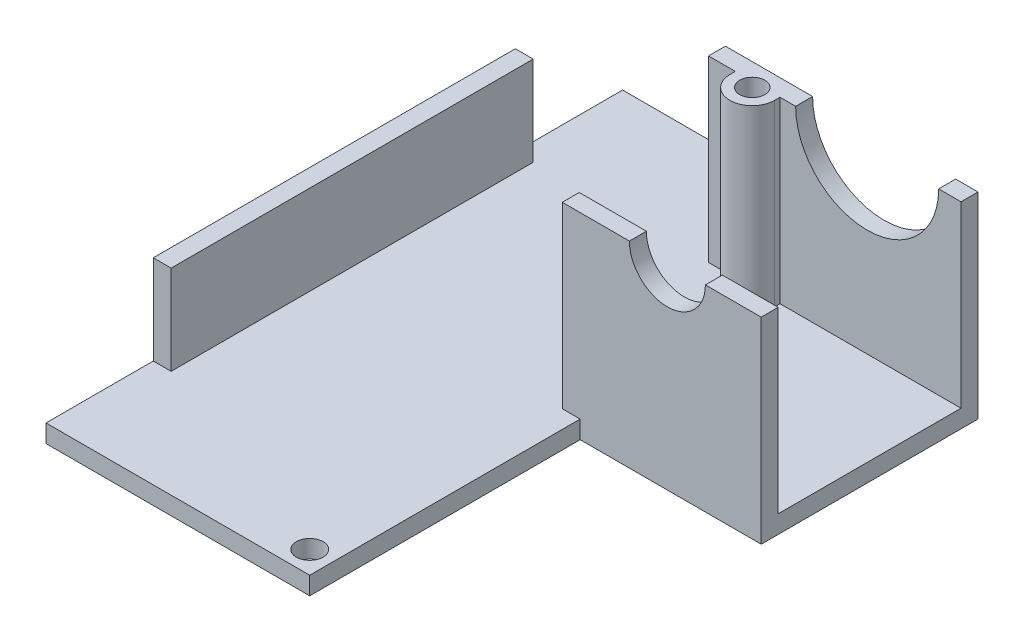
from build123d import *

# Parameters (mm, degrees)
BOSS_EXTRUDE1_DEPTH                 = 2
BOSS_EXTRUDE1_2_DEPTH               = 2
BOSS_EXTRUDE2_DEPTH                 = 1.9
BOSS_EXTRUDE3_DEPTH                 = 1.9
F_16_0MM_DOWEL_HOLE1_D              = 16
F_16_0MM_DOWEL_HOLE1_DEPTH          = 1.9
BOSS_EXTRUDE4_DEPTH                 = 2
F_8_0MM_DOWEL_HOLE1_D               = 8.5
SKETCH10_W                          = 5
SKETCH10_H                          = 3.1
BOSS_EXTRUDE5_DEPTH                 = 20
F_3_0MM_DOWEL_HOLE1_D               = 2.8
F_3_0MM_DOWEL_HOLE1_DEPTH           = 20
F_5_0MM_DOWEL_HOLE1_D               = 3
F_5_0MM_DOWEL_HOLE1_DEPTH           = 2
F_5_0MM_DOWEL_HOLE1_ON_FACE_2_D     = 3
F_5_0MM_DOWEL_HOLE1_ON_FACE_2_DEPTH = 2
FILLET1_RADIUS                      = 2.5
FILLET1_LENGTH                      = 20


with BuildPart() as part:
    # 3DSketch1 → Boss-Extrude1 (new body)
    with BuildSketch(Plane(origin=(0, 0, 0), x_dir=(0.4159263542190885, 0, 0.9093982999027529), z_dir=(0, 1, 0))):
        Polygon((9.774269324, 21.370860048), (0, 0), (58.656190344, -26.827249847), (70.926017793, 0), (43.416719221, 12.581772215), (21.363810448, 22.667986305), (18.868252323, 17.211596506), align=None)
    extrude(amount=BOSS_EXTRUDE1_DEPTH)



with BuildPart() as body_2:
    # 3DSketch1 → Boss-Extrude1 2 (new body)
    with BuildSketch(Plane(origin=(0, 0, 0), x_dir=(0.4159263542190885, 0, 0.9093982999027529), z_dir=(0, 1, 0))):
        Polygon((21.363810448, 22.667986305), (43.416719221, 12.581772215), (51.839227894, 30.997087788), (29.786319121, 41.083301878), align=None)
    extrude(amount=BOSS_EXTRUDE1_2_DEPTH)


with BuildPart() as part_1:
    add(part.part)

    add(body_2.part)  # Boss-Extrude2 merges body 2
    # 3DSketch2 → Boss-Extrude2 (add)
    with BuildSketch(Plane(origin=(27.5, 0, 34.25), x_dir=(0.7110903860866081, 0.7031006064676654, 0), z_dir=(0, 0, 1))):
        Polygon((0, 0), (15.82176109, -15.643988494), (31.289974433, 0), (15.468213342, 15.643988494), align=None)
    extrude(amount=-BOSS_EXTRUDE2_DEPTH)

    # 3DSketch3 → Boss-Extrude3 (add)
    with BuildSketch(Plane(origin=(21.5, 0, 10), x_dir=(0.7889761107100116, 0.6144238738272655, 0), z_dir=(0, 0, -1))):
        Polygon((0, 0), (22.288575128, 17.357474436), (35.805900352, 0), (13.517325224, -17.357474436), align=None)
    extrude(amount=-BOSS_EXTRUDE3_DEPTH)

    # Ø16.0mm Dowel Hole1
    with Locations(Plane(origin=(39.25, 22, 10), x_dir=(-1, 0, 0), z_dir=(0, 0, -1))):
        with Locations((0, 0)):
            Hole(F_16_0MM_DOWEL_HOLE1_D / 2, depth=F_16_0MM_DOWEL_HOLE1_DEPTH)

    # 3DSketch7 → Boss-Extrude4 (add)
    with BuildSketch(Plane(origin=(0, 0, 52.5), x_dir=(0, 0.2840883296913741, -0.9587981127083872), z_dir=(1, 0, 0))):
        Polygon((0, 0), (3.409059956, 11.505577353), (42.240383521, 0), (38.831323565, -11.505577353), align=None)
    extrude(amount=BOSS_EXTRUDE4_DEPTH)

    # Ø8.0mm Dowel Hole1 (through all)
    with Locations(Plane(origin=(39.255, 22, 34.25), x_dir=(1, 0, 0), z_dir=(0, 0, 1))):
        with Locations((0, 0)):
            Hole(F_8_0MM_DOWEL_HOLE1_D / 2)

    # Sketch10 → Boss-Extrude5 (add)
    with BuildSketch(Plane(origin=(0, 2, 0), x_dir=(1, 0, 0), z_dir=(0, 1, 0))):
        with Locations((27, -13.45)):
            Rectangle(SKETCH10_W, SKETCH10_H)
    extrude(amount=BOSS_EXTRUDE5_DEPTH)

    # Ø3.0mm Dowel Hole1
    with Locations(Plane(origin=(27, 22, 12.5), x_dir=(0, 0, 1), z_dir=(0, 1, 0))):
        with Locations((0, 0)):
            Hole(F_3_0MM_DOWEL_HOLE1_D / 2, depth=F_3_0MM_DOWEL_HOLE1_DEPTH)

    # Ø5.0mm Dowel Hole1
    with Locations(Plane(origin=(27, 0, 12.5), x_dir=(0, 0, -1), z_dir=(0, -1, 0))):
        with Locations((0, 0)):
            Hole(F_5_0MM_DOWEL_HOLE1_D / 2, depth=F_5_0MM_DOWEL_HOLE1_DEPTH)

    # Ø5.0mm Dowel Hole1 on face 2
    with Locations(Plane(origin=(27, 2, 62), x_dir=(0, 0, 1), z_dir=(0, 1, 0))):
        with Locations((0, 0)):
            Hole(F_5_0MM_DOWEL_HOLE1_ON_FACE_2_D / 2, depth=F_5_0MM_DOWEL_HOLE1_ON_FACE_2_DEPTH)

    # Fillet1: full round fillet: the end face becomes a half cylinder, R = half its width
    fillet1_face = Plane((27, 12, 15), x_dir=(0, 1, 0), z_dir=(0, 0, 1))  # on the end face: x along it, z out of the body
    fillet1_slab = fillet1_face.offset(-FILLET1_RADIUS / 2) * Box(FILLET1_LENGTH, 2 * FILLET1_RADIUS, FILLET1_RADIUS, mode=Mode.PRIVATE)  # the body's end, R deep
    fillet1_round = Plane((27, 12, 12.5), x_dir=(0, 0, 1), z_dir=(0, 1, 0)) * Cylinder(FILLET1_RADIUS, FILLET1_LENGTH, mode=Mode.PRIVATE)  # its axis R under the face
    add(fillet1_slab - fillet1_round, mode=Mode.SUBTRACT)


solid = part_1.part
